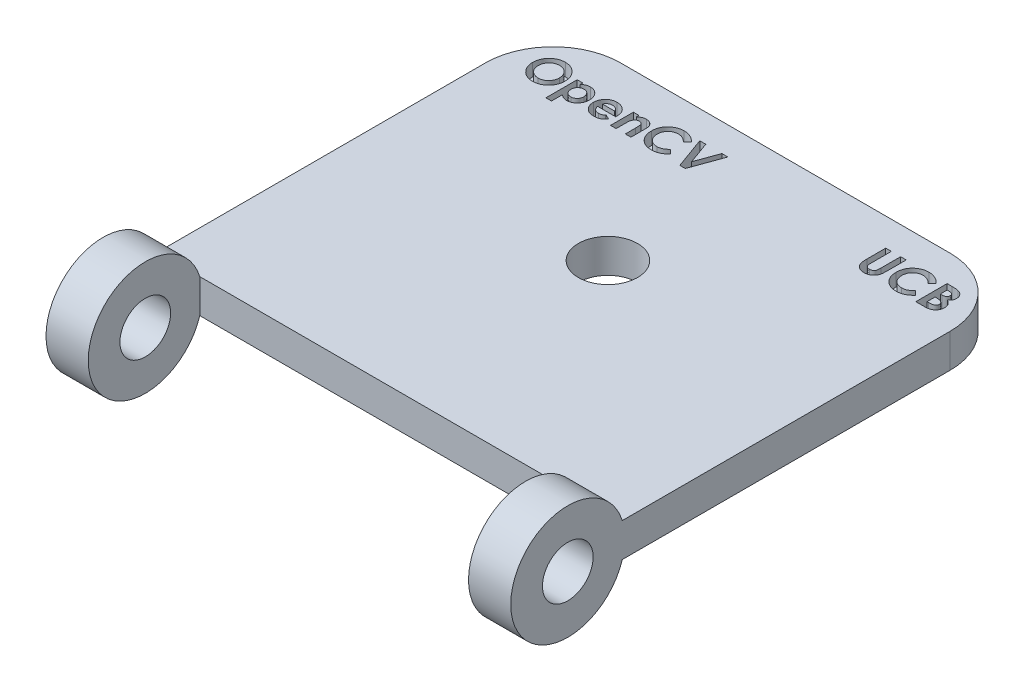
from build123d import *
from build123d.topology import SkipClean

# Parameters (mm, degrees)
CROQUIS1_W                 = 55
CROQUIS1_H                 = 60
SALIENTE_EXTRUIR1_DEPTH    = 4
CROQUIS2_R                 = 6.75
SALIENTE_EXTRUIR2_DEPTH    = 55
CORTAR_EXTRUIR1_DEPTH      = 55
CORTAR_EXTRUIR4_DEPTH      = 72
CROQUIS5_R                 = 3.5
CORTAR_EXTRUIR5_DEPTH      = 72
CORTAR_EXTRUIR6_DEPTH      = 1.5
CORTAR_EXTRUIR8_DEPTH      = 42.627064651
CORTAR_EXTRUIR8_DEPTH_BACK = 42.627064651
CROQUIS7_W                 = 45
CROQUIS7_H                 = 14.979897435
REDONDEO1_R                = 8


with BuildPart() as part:
    # Croquis1 → Saliente-Extruir1 (new body)
    with BuildSketch(Plane(origin=(0, 0, 0), x_dir=(1, 0, 0), z_dir=(0, 1, 0))):
        Rectangle(CROQUIS1_W, CROQUIS1_H)
    extrude(amount=SALIENTE_EXTRUIR1_DEPTH)

    # Croquis2 → Saliente-Extruir2 (add)
    with BuildSketch(Plane(origin=(27.5, 0, 0), x_dir=(0, 0, -1), z_dir=(1, 0, 0))):
        with Locations((-23.25, 2)):
            Circle(CROQUIS2_R)
    extrude(amount=-SALIENTE_EXTRUIR2_DEPTH)

    # Croquis3 → Cortar-Extruir1 (cut)
    with BuildSketch(Plane(origin=(27.5, 0, 0), x_dir=(0, 0, -1), z_dir=(1, 0, 0))):
        with BuildLine():
            ThreePointArc((-20.25, 2), (-21.128679656, 4.121320344), (-23.25, 5))
            Line((-23.25, 5), (-23.25, -1))
            ThreePointArc((-23.25, -1), (-21.128679656, -0.121320344), (-20.25, 2))
        make_face()
        with BuildLine():
            Line((-23.25, -1), (-23.25, 5))
            ThreePointArc((-23.25, 5), (-26.25, 2), (-23.25, -1))
        make_face()
    extrude(amount=-CORTAR_EXTRUIR1_DEPTH, mode=Mode.SUBTRACT)

    # Croquis4 → Cortar-Extruir4 (cut)
    with SkipClean():  # the faces are left unmerged after this step: merging them gives an invalid solid
        with BuildSketch(Plane(origin=(27.5, 0, 0), x_dir=(0, 0, -1), z_dir=(1, 0, 0))):
            with BuildLine():
                Line((-29.696898479, 4), (-30.340484791, 4))
                Line((-30.340484791, 4), (-30.340484791, 0))
                Line((-30.340484791, 0), (-29.696898479, 0))
                ThreePointArc((-29.696898479, 0), (-30, 2), (-29.696898479, 4))
            make_face()
        extrude(amount=-CORTAR_EXTRUIR4_DEPTH, mode=Mode.SUBTRACT)

    # Croquis5 → Cortar-Extruir5 (cut)
    with SkipClean():  # the faces are left unmerged after this step: merging them gives an invalid solid
        with BuildSketch(Plane.XZ):
            with Locations(Location((0, -9, 0), (0, 0, 270))):
                Circle(CROQUIS5_R)
        extrude(amount=-CORTAR_EXTRUIR5_DEPTH, mode=Mode.SUBTRACT)

    # Croquis6 → Cortar-Extruir6 (cut)
    # profile 1 of 9: a face of its own
    with SkipClean():  # the faces are left unmerged after this step: merging them gives an invalid solid
        with BuildSketch(Plane(origin=(0, 4, 0), x_dir=(1, 0, 0), z_dir=(0, 1, 0))):
            with BuildLine():
                add(Edge.make_bspline(
                    [(-22.831815905, 26.799145299), (-22.767414428, 26.79747783), (-22.640271326, 26.794185867), (-22.453289703, 26.766744789), (-22.273098337, 26.722033487), (-22.099778709, 26.659881544), (-21.933764792, 26.578605568), (-21.774470999, 26.480509787), (-21.622467913, 26.363742702), (-21.47931314, 26.231028297), (-21.347012312, 26.086707176), (-21.232373566, 25.931319831), (-21.13461385, 25.768892504), (-21.053590336, 25.598989967), (-20.991875848, 25.420435563), (-20.94856824, 25.234139684), (-20.920745247, 25.040155329), (-20.917545175, 24.908078423), (-20.915918803, 24.840953025)],
                    knots=[0, 0, 0, 0, 1.014329547, 2.002516266, 2.970391464, 3.935626869, 4.897733899, 5.877609409, 6.878433252, 7.912639331, 8.949961323, 9.958554974, 10.949718813, 11.932905612, 12.9188844, 13.919928257, 14.942845884, 16, 16, 16, 16], degree=3))
                add(Edge.make_bspline(
                    [(-20.915918803, 24.840953025), (-20.917650819, 24.774583975), (-20.921063811, 24.643801632), (-20.947432384, 24.451604919), (-20.991469298, 24.267304657), (-21.052137059, 24.090483678), (-21.131691113, 23.921998441), (-21.227544408, 23.760773192), (-21.342226331, 23.608304141), (-21.471553981, 23.464673107), (-21.613932501, 23.334297124), (-21.764733955, 23.219403514), (-21.923262036, 23.122047005), (-22.08928471, 23.04227219), (-22.263158004, 22.980361894), (-22.44445243, 22.936679682), (-22.633156769, 22.91013312), (-22.761484871, 22.906742421), (-22.826621761, 22.905021368)],
                    knots=[0, 0, 0, 0, 1.051557043, 2.072126891, 3.067553643, 4.050577992, 5.02905126, 6.015227836, 7.017913613, 8.04756643, 9.074058332, 10.072836633, 11.047628519, 12.017157415, 12.98668631, 13.966869689, 14.968021931, 16, 16, 16, 16], degree=3))
                add(Edge.make_bspline(
                    [(-22.826621761, 22.905021368), (-22.894747139, 22.906565238), (-23.028604193, 22.909598731), (-23.224504592, 22.93844587), (-23.412194101, 22.981899739), (-23.59009602, 23.046752307), (-23.76002213, 23.127823469), (-23.920723931, 23.227667467), (-24.072147419, 23.346119299), (-24.213424003, 23.480145371), (-24.34142093, 23.62679929), (-24.454403325, 23.781726151), (-24.549706481, 23.943742447), (-24.627333886, 24.112924007), (-24.688532214, 24.288219408), (-24.731700681, 24.47069625), (-24.757201324, 24.659916887), (-24.760753416, 24.788439326), (-24.762553419, 24.853567374)],
                    knots=[0, 0, 0, 0, 1.067978421, 2.098431617, 3.099715153, 4.085208694, 5.062210972, 6.048429807, 7.046490867, 8.072918869, 9.098532598, 10.095778865, 11.076610158, 12.041847152, 13.011192615, 13.984257998, 14.978533688, 16, 16, 16, 16], degree=3))
                add(Edge.make_bspline(
                    [(-24.762553419, 24.853567374), (-24.761988474, 24.897382116), (-24.760865738, 24.984456803), (-24.747341202, 25.113497045), (-24.727869759, 25.240018595), (-24.699072418, 25.363517009), (-24.66409101, 25.484863511), (-24.618767653, 25.602928579), (-24.567177408, 25.718973471), (-24.506899063, 25.831627552), (-24.439875373, 25.939854311), (-24.36674656, 26.043143223), (-24.287328742, 26.140245374), (-24.20187775, 26.231798879), (-24.11009911, 26.317201951), (-24.013200073, 26.397663589), (-23.909301364, 26.471046445), (-23.800676998, 26.539142676), (-23.687939375, 26.600720917), (-23.57154744, 26.653134474), (-23.453899096, 26.69890634), (-23.333422719, 26.735031521), (-23.21140943, 26.764455103), (-23.086555762, 26.783913423), (-22.959989697, 26.797437584), (-22.874641897, 26.79857471), (-22.831815905, 26.799145299)],
                    knots=[0, 0, 0, 0, 1.034744296, 2.056386356, 3.06226378, 4.057406941, 5.050368692, 6.043467995, 7.042652155, 8.049140477, 9.059438543, 10.048523776, 11.036952808, 12.020949711, 13.004946614, 13.997082645, 14.994316842, 16.007702937, 17.024872941, 18.026463647, 19.021641123, 20.005082605, 20.995858141, 21.984425357, 22.988620895, 24, 24, 24, 24], degree=3))
            make_face()
            with BuildLine():
                add(Edge.make_bspline(
                    [(-22.842204193, 26.134294872), (-22.885546379, 26.133131904), (-22.971086509, 26.13083667), (-23.096558303, 26.113350093), (-23.217015655, 26.085422042), (-23.331790824, 26.044968602), (-23.441381255, 25.993481639), (-23.545981219, 25.931141056), (-23.644142221, 25.855803965), (-23.737173144, 25.771514878), (-23.821211274, 25.677597464), (-23.895461613, 25.576948983), (-23.957597188, 25.469737516), (-24.009636121, 25.356959032), (-24.048809904, 25.237345367), (-24.076712215, 25.111833467), (-24.094345434, 24.98020707), (-24.096568124, 24.890477526), (-24.097702991, 24.844663128)],
                    knots=[0, 0, 0, 0, 1.033739768, 2.040188636, 3.016340934, 3.979330865, 4.937572243, 5.900995986, 6.878200029, 7.884839167, 8.891893314, 9.879764717, 10.863503415, 11.843163062, 12.837761627, 13.859916423, 14.907309254, 16, 16, 16, 16], degree=3))
                add(Edge.make_bspline(
                    [(-24.097702991, 24.844663128), (-24.09619833, 24.793890468), (-24.093249443, 24.694384468), (-24.072500715, 24.549227797), (-24.037001707, 24.412141727), (-23.985741829, 24.283796727), (-23.922166132, 24.162767622), (-23.843215207, 24.050537794), (-23.750167685, 23.946435265), (-23.678484627, 23.885655873), (-23.642102364, 23.854807692)],
                    knots=[0, 0, 0, 0, 1.078454662, 2.113592447, 3.107694534, 4.079536787, 5.043276885, 6.005368276, 6.987637804, 8, 8, 8, 8], degree=3))
                add(Edge.make_bspline(
                    [(-23.642102364, 23.854807692), (-23.612298344, 23.832018241), (-23.553361794, 23.78695279), (-23.459286229, 23.729192169), (-23.362406921, 23.679685554), (-23.261992795, 23.639684795), (-23.15825592, 23.608220871), (-23.051210521, 23.586187202), (-22.941008273, 23.572359169), (-22.866484348, 23.570706457), (-22.828847823, 23.569871795)],
                    knots=[0, 0, 0, 0, 1.023928204, 2.024787132, 3.009472467, 3.9914905, 4.972207045, 5.96565515, 6.972602802, 8, 8, 8, 8], degree=3))
                add(Edge.make_bspline(
                    [(-22.828847823, 23.569871795), (-22.786250907, 23.571044624), (-22.702440136, 23.573352201), (-22.579304068, 23.590623509), (-22.461335975, 23.619852797), (-22.347803501, 23.659951366), (-22.239034023, 23.712084791), (-22.135559127, 23.776358984), (-22.037197393, 23.851984738), (-21.94428499, 23.937380725), (-21.859358662, 24.031668109), (-21.785263268, 24.132853438), (-21.721152093, 24.238707299), (-21.67019531, 24.350727891), (-21.629473859, 24.467857792), (-21.601907367, 24.590615746), (-21.584125187, 24.718495698), (-21.581901871, 24.805522525), (-21.580769231, 24.849857272)],
                    knots=[0, 0, 0, 0, 1.026359118, 2.019393844, 2.989460624, 3.950973911, 4.916101784, 5.890408035, 6.881132271, 7.902007068, 8.92769091, 9.933912415, 10.920395702, 11.90457117, 12.894218921, 13.903490204, 14.931958862, 16, 16, 16, 16], degree=3))
                add(Edge.make_bspline(
                    [(-21.580769231, 24.849857272), (-21.581941061, 24.893937081), (-21.58424763, 24.980701464), (-21.601549336, 25.108252638), (-21.63059326, 25.230468652), (-21.67081224, 25.347549097), (-21.722169748, 25.459608757), (-21.785678517, 25.566253564), (-21.861115702, 25.667380417), (-21.946745122, 25.762300176), (-22.039947482, 25.849525354), (-22.140009528, 25.925220953), (-22.244131412, 25.990998022), (-22.354702198, 26.042525121), (-22.4694597, 26.083576652), (-22.589104175, 26.113807589), (-22.714088783, 26.130713826), (-22.799118396, 26.13309055), (-22.842204193, 26.134294872)],
                    knots=[0, 0, 0, 0, 1.055025985, 2.07665775, 3.074803781, 4.057872707, 5.035505728, 6.020516407, 7.023567878, 8.050795229, 9.077271434, 10.074415901, 11.050397877, 12.019801805, 12.988065821, 13.964604439, 14.968634123, 16, 16, 16, 16], degree=3))
            make_face(mode=Mode.SUBTRACT)
        # profile 2 of 9: a face of its own
        with BuildSketch(Plane(origin=(0, 4, 0), x_dir=(1, 0, 0), z_dir=(0, 1, 0))):
            with BuildLine():
                Line((-19.681196581, 25.706891026), (-19.681196581, 25.401920573))
                add(Edge.make_bspline(
                    [(-19.681196581, 25.401920573), (-19.650330497, 25.430279773), (-19.589712693, 25.485974315), (-19.490464949, 25.557279954), (-19.388472911, 25.618520433), (-19.281862583, 25.667777408), (-19.172097048, 25.706588005), (-19.058192745, 25.733858099), (-18.940987103, 25.751843458), (-18.861330635, 25.75353037), (-18.821194745, 25.754380342)],
                    knots=[0, 0, 0, 0, 1.054376801, 2.070687235, 3.070225973, 4.045259405, 5.022040922, 5.996139433, 6.99033025, 8, 8, 8, 8], degree=3))
                add(Edge.make_bspline(
                    [(-18.821194745, 25.754380342), (-18.777594579, 25.753336008), (-18.691716399, 25.751279009), (-18.565362998, 25.732073969), (-18.444276078, 25.701030344), (-18.327993903, 25.657684982), (-18.217136011, 25.601408269), (-18.110456835, 25.53402753), (-18.009796182, 25.452762268), (-17.915105119, 25.360715732), (-17.827513527, 25.259825891), (-17.751324973, 25.150137222), (-17.687862864, 25.033093437), (-17.634075608, 24.910078238), (-17.594819509, 24.779051461), (-17.564564183, 24.64177074), (-17.547704217, 24.497074652), (-17.545368211, 24.398502149), (-17.54417735, 24.348251369)],
                    knots=[0, 0, 0, 0, 0.985987466, 1.942075377, 2.884088208, 3.810275091, 4.743821533, 5.692411115, 6.659945104, 7.665215984, 8.677116751, 9.678438675, 10.680260931, 11.685531812, 12.710472044, 13.769734641, 14.863044265, 16, 16, 16, 16], degree=3))
                add(Edge.make_bspline(
                    [(-17.54417735, 24.348251369), (-17.545304421, 24.299720807), (-17.547526125, 24.20405637), (-17.565476095, 24.063613104), (-17.595899791, 23.929449972), (-17.638578071, 23.801518656), (-17.692833664, 23.679414871), (-17.759056359, 23.563222754), (-17.837632448, 23.45334816), (-17.927465195, 23.351271212), (-18.025620525, 23.258832947), (-18.127891344, 23.175897445), (-18.23631455, 23.107938305), (-18.348179804, 23.050541604), (-18.465249409, 23.006651458), (-18.586723728, 22.975901478), (-18.712410375, 22.955343208), (-18.797861986, 22.953464262), (-18.8412293, 22.952510684)],
                    knots=[0, 0, 0, 0, 1.098553145, 2.165490463, 3.199345634, 4.208780719, 5.21409072, 6.219899742, 7.23156933, 8.267303578, 9.293302409, 10.281606823, 11.243293419, 12.184993323, 13.124258899, 14.066907486, 15.018941492, 16, 16, 16, 16], degree=3))
                add(Edge.make_bspline(
                    [(-18.8412293, 22.952510684), (-18.879874596, 22.953447909), (-18.956003503, 22.955294186), (-19.06794929, 22.971756088), (-19.176090191, 22.996344574), (-19.280569255, 23.033352987), (-19.382561013, 23.08246284), (-19.483802512, 23.143620283), (-19.584527861, 23.218334509), (-19.648282325, 23.275961581), (-19.681196581, 23.305712473)],
                    knots=[0, 0, 0, 0, 0.990856396, 1.951927477, 2.896945079, 3.83213376, 4.788585491, 5.796263726, 6.862286081, 8, 8, 8, 8], degree=3))
                Line((-19.681196581, 23.305712473), (-19.681196581, 22.002724359))
                Line((-19.681196581, 22.002724359), (-20.346047009, 22.002724359))
                Line((-20.346047009, 22.002724359), (-20.346047009, 25.706891026))
                Line((-20.346047009, 25.706891026), (-19.681196581, 25.706891026))
            make_face()
            with BuildLine():
                add(Edge.make_bspline(
                    [(-18.965146735, 25.137019231), (-18.992128349, 25.136189528), (-19.045026979, 25.134562858), (-19.122691804, 25.125240424), (-19.196280593, 25.107700196), (-19.266912203, 25.084966264), (-19.333692237, 25.054279026), (-19.397167029, 25.017079786), (-19.456792913, 24.972722532), (-19.512879345, 24.922963756), (-19.563277464, 24.86698504), (-19.60805182, 24.807168878), (-19.645198113, 24.742736352), (-19.676163596, 24.674504458), (-19.699525701, 24.601734934), (-19.716853614, 24.525046832), (-19.726270236, 24.444205136), (-19.727867942, 24.389084892), (-19.728685897, 24.360865718)],
                    knots=[0, 0, 0, 0, 1.060469436, 2.079096586, 3.066888298, 4.028858836, 4.99004353, 5.948472697, 6.914558426, 7.905691313, 8.889602648, 9.869280844, 10.836099585, 11.806137001, 12.808075328, 13.83377171, 14.890985086, 16, 16, 16, 16], degree=3))
                add(Edge.make_bspline(
                    [(-19.728685897, 24.360865718), (-19.727857649, 24.332152686), (-19.726232177, 24.275802124), (-19.716894054, 24.193236587), (-19.699687765, 24.115012068), (-19.675833611, 24.040951211), (-19.645395046, 23.971044407), (-19.608292765, 23.905032502), (-19.563025559, 23.844362772), (-19.513181082, 23.786908139), (-19.456747854, 23.73648358), (-19.397390586, 23.691259687), (-19.333707658, 23.654004998), (-19.26660848, 23.623819893), (-19.196602196, 23.598736236), (-19.122645578, 23.581787235), (-19.045039245, 23.572291912), (-18.992132492, 23.570689252), (-18.965146735, 23.569871795)],
                    knots=[0, 0, 0, 0, 1.117193555, 2.192540452, 3.22680955, 4.227918444, 5.21468246, 6.188555072, 7.166222992, 8.154674427, 9.142376254, 10.104580718, 11.053462639, 12.005072638, 12.963662044, 13.941614018, 14.950094269, 16, 16, 16, 16], degree=3))
                add(Edge.make_bspline(
                    [(-18.965146735, 23.569871795), (-18.939142576, 23.570631187), (-18.88766926, 23.572134349), (-18.812355077, 23.582622883), (-18.739959384, 23.599762191), (-18.671049134, 23.624191904), (-18.605204845, 23.655999366), (-18.541827087, 23.69321936), (-18.483103901, 23.739722965), (-18.426731478, 23.790834397), (-18.376293219, 23.848473391), (-18.331044039, 23.909707232), (-18.293033383, 23.975082443), (-18.262853818, 24.044815817), (-18.237903512, 24.117586504), (-18.22086915, 24.194726459), (-18.211497156, 24.275547153), (-18.209859082, 24.330666983), (-18.209027778, 24.358639657)],
                    knots=[0, 0, 0, 0, 1.021711385, 2.02240246, 2.981887075, 3.941027022, 4.888772411, 5.852236371, 6.822344989, 7.82661704, 8.838806642, 9.826383926, 10.814965113, 11.80282933, 12.807900643, 13.833672313, 14.900613836, 16, 16, 16, 16], degree=3))
                add(Edge.make_bspline(
                    [(-18.209027778, 24.358639657), (-18.209872357, 24.386360671), (-18.211536415, 24.440978831), (-18.22071649, 24.521126504), (-18.238406701, 24.597144977), (-18.260742843, 24.669655264), (-18.291948436, 24.737713471), (-18.328845903, 24.802124715), (-18.372262609, 24.863083482), (-18.422627859, 24.918944183), (-18.477869662, 24.969773408), (-18.536839345, 25.014732276), (-18.599305329, 25.053005083), (-18.666118265, 25.083187527), (-18.735701472, 25.108021173), (-18.809118328, 25.125126916), (-18.885995587, 25.134594192), (-18.938408662, 25.136200028), (-18.965146735, 25.137019231)],
                    knots=[0, 0, 0, 0, 1.094680664, 2.156827393, 3.177782763, 4.17210342, 5.146667393, 6.126451192, 7.099203661, 8.094961544, 9.09004898, 10.058676268, 11.018205477, 11.974998356, 12.947750825, 13.930643515, 14.944335875, 16, 16, 16, 16], degree=3))
            make_face(mode=Mode.SUBTRACT)
        # profile 3 of 9: a face of its own
        with BuildSketch(Plane(origin=(0, 4, 0), x_dir=(1, 0, 0), z_dir=(0, 1, 0))):
            with BuildLine():
                Line((-14.269640592, 24.187232906), (-16.404433761, 24.187232906))
                add(Edge.make_bspline(
                    [(-16.404433761, 24.187232906), (-16.40008109, 24.16242782), (-16.391527748, 24.11368387), (-16.372953863, 24.042879053), (-16.349250799, 23.976153789), (-16.32084417, 23.913418881), (-16.288212911, 23.854342677), (-16.25015125, 23.799202265), (-16.207141967, 23.748046349), (-16.159433727, 23.701097259), (-16.107821742, 23.659029857), (-16.05255631, 23.622176154), (-15.993580401, 23.591958372), (-15.931570151, 23.566487917), (-15.866062202, 23.546312736), (-15.796960141, 23.532398298), (-15.724447149, 23.524178988), (-15.675049083, 23.522990159), (-15.649798845, 23.522382479)],
                    knots=[0, 0, 0, 0, 1.091296461, 2.144483647, 3.168565212, 4.157007626, 5.126487748, 6.090021542, 7.05641414, 8.019231907, 8.98705074, 9.938580405, 10.892824166, 11.854447369, 12.841318655, 13.858982407, 14.905600794, 16, 16, 16, 16], degree=3))
                add(Edge.make_bspline(
                    [(-15.649798845, 23.522382479), (-15.619320093, 23.523187147), (-15.559298456, 23.524771776), (-15.47136631, 23.538825084), (-15.386323117, 23.560051987), (-15.304973683, 23.591618174), (-15.226375704, 23.630912528), (-15.151823144, 23.679868458), (-15.080025557, 23.737055312), (-15.036220567, 23.781134917), (-15.01388722, 23.803608273)],
                    knots=[0, 0, 0, 0, 1.021034703, 2.010718019, 2.977989445, 3.954245119, 4.929443971, 5.918328161, 6.938689359, 8, 8, 8, 8], degree=3))
                Line((-15.01388722, 23.803608273), (-14.457371795, 23.538706931))
                add(Edge.make_bspline(
                    [(-14.457371795, 23.538706931), (-14.474893358, 23.51449482), (-14.509611692, 23.466519411), (-14.566288206, 23.399005621), (-14.625433757, 23.336012516), (-14.687092457, 23.277954411), (-14.751342503, 23.22499675), (-14.818005167, 23.176494411), (-14.888054698, 23.133749663), (-14.960090467, 23.094694542), (-15.035601587, 23.061212767), (-15.114379086, 23.032660692), (-15.196089296, 23.006849858), (-15.281764041, 22.987183417), (-15.370689908, 22.971615623), (-15.463079625, 22.960560427), (-15.558921016, 22.953732162), (-15.624063851, 22.952922679), (-15.65721905, 22.952510684)],
                    knots=[0, 0, 0, 0, 1.028154879, 2.037251081, 3.030720504, 4.000128189, 4.949298328, 5.894184978, 6.834267904, 7.770992897, 8.712077017, 9.673380525, 10.653304757, 11.658697181, 12.695551717, 13.758623199, 14.859225354, 16, 16, 16, 16], degree=3))
                add(Edge.make_bspline(
                    [(-15.65721905, 22.952510684), (-15.70822778, 22.953550598), (-15.808125437, 22.955587211), (-15.95424382, 22.974489891), (-16.093015756, 23.005832573), (-16.224833089, 23.048438135), (-16.349126016, 23.104690824), (-16.465956051, 23.173492529), (-16.576490493, 23.253524184), (-16.677351897, 23.34646544), (-16.769239612, 23.447626472), (-16.849948067, 23.556266512), (-16.917483754, 23.671626533), (-16.972945418, 23.79294306), (-17.016052149, 23.920526613), (-17.047129603, 24.054432869), (-17.066180454, 24.194597872), (-17.06823804, 24.290065885), (-17.069284188, 24.338605101)],
                    knots=[0, 0, 0, 0, 1.103565453, 2.161269334, 3.182010356, 4.179077853, 5.15417608, 6.128274628, 7.109042802, 8.101804412, 9.090965879, 10.063106201, 11.02526161, 11.978650795, 12.945248442, 13.93468508, 14.949922959, 16, 16, 16, 16], degree=3))
                add(Edge.make_bspline(
                    [(-17.069284188, 24.338605101), (-17.068227744, 24.388377762), (-17.066149238, 24.486303236), (-17.04729363, 24.629704713), (-17.015966231, 24.766529117), (-16.972733402, 24.896964871), (-16.918113099, 25.021419922), (-16.849718137, 25.138805437), (-16.769279663, 25.249530088), (-16.677722972, 25.353075895), (-16.576434288, 25.446537299), (-16.468805491, 25.529830087), (-16.353627263, 25.599235167), (-16.232202367, 25.655314428), (-16.105307482, 25.700877412), (-15.971475879, 25.731195773), (-15.831725814, 25.751552738), (-15.736195746, 25.753427487), (-15.687641894, 25.754380342)],
                    knots=[0, 0, 0, 0, 1.079208495, 2.12329425, 3.130605359, 4.119693003, 5.099659317, 6.073216462, 7.060498243, 8.06384408, 9.066070512, 10.045757761, 11.010926815, 11.975797609, 12.942977511, 13.929384301, 14.947594487, 16, 16, 16, 16], degree=3))
                add(Edge.make_bspline(
                    [(-15.687641894, 25.754380342), (-15.636388798, 25.753324294), (-15.535758625, 25.751250852), (-15.388622573, 25.732501657), (-15.248929209, 25.700967852), (-15.116083359, 25.658730692), (-14.991781521, 25.601057001), (-14.873292405, 25.533948397), (-14.763458053, 25.452186797), (-14.661107748, 25.359700366), (-14.56871568, 25.257089875), (-14.487954775, 25.145623455), (-14.419237185, 25.026388953), (-14.363540897, 24.898902846), (-14.320478427, 24.763547861), (-14.289372206, 24.620499783), (-14.270466668, 24.469214526), (-14.268447368, 24.365620839), (-14.26741453, 24.312634382)],
                    knots=[0, 0, 0, 0, 1.080001299, 2.120471247, 3.119684163, 4.095710327, 5.052285597, 6.002875087, 6.961153713, 7.931888285, 8.906493152, 9.865905668, 10.82813294, 11.801621613, 12.7925306, 13.817193356, 14.883530496, 16, 16, 16, 16], degree=3))
                Line((-14.26741453, 24.312634382), (-14.269640592, 24.187232906))
            make_face()
            with BuildLine():
                add(Edge.make_bspline(
                    [(-14.932264957, 24.709615385), (-14.944811091, 24.743472319), (-14.969756075, 24.810788723), (-15.026105753, 24.903668936), (-15.100879974, 24.984106973), (-15.187847756, 25.055319404), (-15.287213894, 25.113119862), (-15.395847185, 25.154969271), (-15.512374525, 25.180062701), (-15.592539056, 25.18300572), (-15.633474392, 25.184508547)],
                    knots=[0, 0, 0, 0, 0.954238005, 1.897273737, 2.851915805, 3.847685534, 4.862635127, 5.880135777, 6.917509367, 8, 8, 8, 8], degree=3))
                add(Edge.make_bspline(
                    [(-15.633474392, 25.184508547), (-15.678182444, 25.183064898), (-15.765577376, 25.180242866), (-15.891638615, 25.150229513), (-16.010549027, 25.105435482), (-16.080651867, 25.059251884), (-16.11578776, 25.036104434)],
                    knots=[0, 0, 0, 0, 1.044195649, 2.041185066, 3.018232172, 4, 4, 4, 4], degree=3))
                add(Edge.make_bspline(
                    [(-16.11578776, 25.036104434), (-16.137709934, 25.018474829), (-16.184446887, 24.980889412), (-16.245144302, 24.905910075), (-16.304931761, 24.815126929), (-16.338924228, 24.746170716), (-16.356944444, 24.709615385)],
                    knots=[0, 0, 0, 0, 0.82159062, 1.751589201, 2.808063854, 4, 4, 4, 4], degree=3))
                Line((-16.356944444, 24.709615385), (-14.932264957, 24.709615385))
            make_face(mode=Mode.SUBTRACT)
        # profile 4 of 9: a face of its own
        with BuildSketch(Plane(origin=(0, 4, 0), x_dir=(1, 0, 0), z_dir=(0, 1, 0))):
            with BuildLine():
                Line((-13.697542735, 25.706891026), (-13.032692308, 25.706891026))
                Line((-13.032692308, 25.706891026), (-13.032692308, 25.420471087))
                add(Edge.make_bspline(
                    [(-13.032692308, 25.420471087), (-12.99476292, 25.449973346), (-12.922272488, 25.506357897), (-12.812074515, 25.578248487), (-12.708061272, 25.637088049), (-12.607914192, 25.68184443), (-12.509749006, 25.714044722), (-12.411975857, 25.737178711), (-12.313138707, 25.75199204), (-12.24669615, 25.753584668), (-12.213501603, 25.754380342)],
                    knots=[0, 0, 0, 0, 1.276643801, 2.439914479, 3.493451431, 4.44993799, 5.350072675, 6.235028322, 7.118224225, 8, 8, 8, 8], degree=3))
                add(Edge.make_bspline(
                    [(-12.213501603, 25.754380342), (-12.179830201, 25.753471052), (-12.113730411, 25.751686039), (-12.016402113, 25.739201319), (-11.923414377, 25.71646269), (-11.833721631, 25.68627194), (-11.748236795, 25.646421882), (-11.665912627, 25.599106403), (-11.588517422, 25.541472949), (-11.540854028, 25.497582078), (-11.516744291, 25.475380609)],
                    knots=[0, 0, 0, 0, 1.048836932, 2.058954983, 3.049370783, 4.026390553, 5.001981509, 5.982488534, 6.97947532, 8, 8, 8, 8], degree=3))
                add(Edge.make_bspline(
                    [(-11.516744291, 25.475380609), (-11.497407395, 25.45480634), (-11.458592079, 25.413507222), (-11.409747881, 25.342833854), (-11.367834066, 25.265786946), (-11.333491518, 25.181477739), (-11.308113758, 25.089443007), (-11.288590301, 24.990794399), (-11.277635349, 24.884979555), (-11.276282909, 24.812285756), (-11.275587607, 24.774913194)],
                    knots=[0, 0, 0, 0, 0.889584746, 1.785680191, 2.700364693, 3.65222533, 4.649950538, 5.707241244, 6.821271309, 8, 8, 8, 8], degree=3))
                Line((-11.275587607, 24.774913194), (-11.275587607, 23))
                Line((-11.275587607, 23), (-11.940438034, 23))
                Line((-11.940438034, 23), (-11.940438034, 24.175360577))
                add(Edge.make_bspline(
                    [(-11.940438034, 24.175360577), (-11.940578635, 24.213698791), (-11.940848071, 24.287166864), (-11.942916744, 24.392310716), (-11.946955999, 24.487269269), (-11.950637674, 24.572215415), (-11.957866266, 24.646847537), (-11.964385128, 24.711638115), (-11.974387688, 24.765999363), (-11.987402642, 24.824473041), (-12.010129957, 24.887079807), (-12.045413006, 24.953046378), (-12.090174502, 25.009086451), (-12.142586205, 25.055592894), (-12.202590232, 25.092383756), (-12.269461521, 25.11826842), (-12.342841563, 25.134400377), (-12.393971914, 25.136124069), (-12.420525341, 25.137019231)],
                    knots=[0, 0, 0, 0, 1.49886392, 2.872294502, 4.110984203, 5.214877267, 6.195405875, 7.042225351, 7.75923308, 8.355011229, 9.382752534, 10.352059385, 11.267231453, 12.171456522, 13.078624015, 14.003401117, 14.963110155, 16, 16, 16, 16], degree=3))
                add(Edge.make_bspline(
                    [(-12.420525341, 25.137019231), (-12.455059189, 25.13526801), (-12.522614109, 25.131842282), (-12.620318786, 25.106009167), (-12.710058904, 25.062074643), (-12.791101213, 25.001278095), (-12.862673851, 24.926217224), (-12.921622975, 24.836698525), (-12.969973367, 24.734882525), (-12.990764754, 24.660540308), (-13.001527444, 24.622056958)],
                    knots=[0, 0, 0, 0, 0.984188326, 1.925263693, 2.85911992, 3.81709677, 4.80007086, 5.801799564, 6.862098548, 8, 8, 8, 8], degree=3))
                add(Edge.make_bspline(
                    [(-13.001527444, 24.622056958), (-13.0042024, 24.609971004), (-13.01016809, 24.583016896), (-13.015074115, 24.537480878), (-13.021898752, 24.483456802), (-13.024455776, 24.419966983), (-13.028902159, 24.347311892), (-13.030546643, 24.26539541), (-13.032194071, 24.174378159), (-13.032520727, 24.110806067), (-13.032692308, 24.077413862)],
                    knots=[0, 0, 0, 0, 0.543362196, 1.211806945, 2.009705693, 2.934833164, 4.000995085, 5.207458376, 6.533175157, 8, 8, 8, 8], degree=3))
                Line((-13.032692308, 24.077413862), (-13.032692308, 23))
                Line((-13.032692308, 23), (-13.697542735, 23))
                Line((-13.697542735, 23), (-13.697542735, 25.706891026))
            make_face()
        # profile 5 of 9: a face of its own
        with BuildSketch(Plane(origin=(0, 4, 0), x_dir=(1, 0, 0), z_dir=(0, 1, 0))):
            with BuildLine():
                Line((-7.19150641, 26.061576856), (-7.679013922, 25.595587941))
                add(Edge.make_bspline(
                    [(-7.679013922, 25.595587941), (-7.720368281, 25.638348417), (-7.8011463, 25.721873024), (-7.931310087, 25.832452242), (-8.066675686, 25.924605059), (-8.204609829, 26.002215574), (-8.347593553, 26.06093346), (-8.493973576, 26.103722173), (-8.644684577, 26.129808834), (-8.746679985, 26.13279361), (-8.797980936, 26.134294872)],
                    knots=[0, 0, 0, 0, 1.115251505, 2.178435587, 3.19620269, 4.182487026, 5.141301733, 6.088180966, 7.038406374, 8, 8, 8, 8], degree=3))
                add(Edge.make_bspline(
                    [(-8.797980936, 26.134294872), (-8.840823465, 26.133108822), (-8.925368474, 26.130768284), (-9.049502703, 26.113609833), (-9.168243509, 26.084431139), (-9.281997359, 26.044217494), (-9.390429529, 25.992183172), (-9.49376736, 25.928368446), (-9.591756077, 25.853349654), (-9.683101305, 25.767514946), (-9.76666071, 25.673734077), (-9.840490764, 25.573670114), (-9.902335278, 25.467552297), (-9.953090064, 25.35645531), (-9.992626081, 25.239864941), (-10.020859764, 25.117859683), (-10.037189372, 24.990294237), (-10.039626675, 24.903576198), (-10.040865385, 24.859503539)],
                    knots=[0, 0, 0, 0, 1.035432265, 2.043311493, 3.022114605, 3.98653278, 4.95457646, 5.923598177, 6.917315552, 7.932509744, 8.948865224, 9.949768934, 10.933144597, 11.912367597, 12.897413939, 13.903909035, 14.934704909, 16, 16, 16, 16], degree=3))
                add(Edge.make_bspline(
                    [(-10.040865385, 24.859503539), (-10.040508403, 24.828570263), (-10.039804784, 24.767600142), (-10.032102434, 24.67740841), (-10.019699834, 24.589901108), (-10.001750198, 24.505210786), (-9.979304003, 24.42326405), (-9.952969505, 24.343353951), (-9.919933264, 24.266584665), (-9.883262538, 24.192064568), (-9.840614907, 24.121827033), (-9.794632893, 24.054849714), (-9.744772907, 23.991460928), (-9.690712001, 23.931919809), (-9.631689336, 23.877156852), (-9.56923043, 23.82552527), (-9.502281688, 23.778317576), (-9.432233804, 23.734349041), (-9.358481652, 23.696153201), (-9.283026301, 23.661555148), (-9.204723695, 23.633456386), (-9.124527214, 23.61080622), (-9.042723454, 23.591545636), (-8.958512297, 23.579686303), (-8.872623749, 23.570705369), (-8.814577506, 23.570150849), (-8.785366587, 23.569871795)],
                    knots=[0, 0, 0, 0, 1.103660481, 2.175337485, 3.227646561, 4.255952547, 5.262355991, 6.258840057, 7.255597736, 8.242457506, 9.22035537, 10.185017736, 11.140346927, 12.096287581, 13.051739095, 14.01125915, 14.986044842, 15.97314143, 16.960198552, 17.947847494, 18.933482797, 19.925264591, 20.920966487, 21.929612487, 22.958107872, 24, 24, 24, 24], degree=3))
                add(Edge.make_bspline(
                    [(-8.785366587, 23.569871795), (-8.735819847, 23.57130495), (-8.638473388, 23.574120726), (-8.495603462, 23.596139697), (-8.359462656, 23.632359658), (-8.250686803, 23.675133328), (-8.165463795, 23.717372882), (-8.10058478, 23.75644239), (-8.033494821, 23.800145924), (-7.965308226, 23.850132903), (-7.89525803, 23.905803462), (-7.824580782, 23.968376893), (-7.751467131, 24.03579274), (-7.703571103, 24.083908754), (-7.679013922, 24.108578726)],
                    knots=[0, 0, 0, 0, 1.404581149, 2.759636711, 4.088442092, 5.392261763, 6.066678138, 6.783632037, 7.538459478, 8.336747902, 9.180226004, 10.074962426, 11.012997595, 12, 12, 12, 12], degree=3))
                Line((-7.679013922, 24.108578726), (-7.206346822, 23.612166967))
                add(Edge.make_bspline(
                    [(-7.206346822, 23.612166967), (-7.239572775, 23.580088353), (-7.304422729, 23.517477757), (-7.402247086, 23.428576554), (-7.499948326, 23.348688941), (-7.595166192, 23.274915346), (-7.689460452, 23.209404975), (-7.782821106, 23.152092401), (-7.874191271, 23.101528106), (-7.965468276, 23.058564832), (-8.057220096, 23.02208455), (-8.151621936, 22.990677422), (-8.248962392, 22.964108121), (-8.349835975, 22.942670185), (-8.453301797, 22.925479855), (-8.560328162, 22.913876481), (-8.670236468, 22.906075919), (-8.744788975, 22.905374974), (-8.782398504, 22.905021368)],
                    knots=[0, 0, 0, 0, 1.244526981, 2.429050516, 3.560637417, 4.644440555, 5.67424972, 6.652764056, 7.595344123, 8.486817594, 9.369275933, 10.254498637, 11.166417451, 12.086725134, 13.032340136, 13.991389299, 14.986715468, 16, 16, 16, 16], degree=3))
                add(Edge.make_bspline(
                    [(-8.782398504, 22.905021368), (-8.85148255, 22.906782458), (-8.986660825, 22.910228421), (-9.184761063, 22.93576068), (-9.37295097, 22.978565062), (-9.55168838, 23.039102265), (-9.720916456, 23.116435704), (-9.880591905, 23.211242869), (-10.030457366, 23.323271872), (-10.169302221, 23.451209625), (-10.294894, 23.592506132), (-10.405902589, 23.744219818), (-10.497728898, 23.9070963), (-10.573974261, 24.078729371), (-10.633597132, 24.259902259), (-10.675561525, 24.45081094), (-10.70144066, 24.651271078), (-10.704271874, 24.788189973), (-10.705715812, 24.858019498)],
                    knots=[0, 0, 0, 0, 1.078019885, 2.10938526, 3.111377082, 4.085535484, 5.04941344, 6.010039228, 6.978205633, 7.964457913, 8.951525778, 9.924444315, 10.892603023, 11.863865945, 12.85144698, 13.863884204, 14.910567087, 16, 16, 16, 16], degree=3))
                add(Edge.make_bspline(
                    [(-10.705715812, 24.858019498), (-10.705105674, 24.903561718), (-10.703896529, 24.993815268), (-10.691188309, 25.126766059), (-10.673472311, 25.256369299), (-10.64536749, 25.381279276), (-10.611489901, 25.50317876), (-10.569358668, 25.620742844), (-10.519041081, 25.734309419), (-10.462158993, 25.844068604), (-10.397808857, 25.949301357), (-10.32592269, 26.049103564), (-10.248351123, 26.144245679), (-10.163230237, 26.233465465), (-10.071796952, 26.317546289), (-9.973638454, 26.396032502), (-9.86934512, 26.470049684), (-9.758634666, 26.537689112), (-9.643657901, 26.598872569), (-9.525864984, 26.652838992), (-9.405545319, 26.697942493), (-9.283207629, 26.735354184), (-9.158335038, 26.763279366), (-9.031818855, 26.784417828), (-8.902582579, 26.796234363), (-8.815811616, 26.798168806), (-8.772010216, 26.799145299)],
                    knots=[0, 0, 0, 0, 1.071919942, 2.124283339, 3.142214191, 4.149696895, 5.136002878, 6.119640489, 7.086990633, 8.058538607, 9.028339693, 9.988281803, 10.952401235, 11.916291999, 12.888973767, 13.874849856, 14.873389453, 15.898127285, 16.927174885, 17.938320013, 18.946391617, 19.950418109, 20.947802303, 21.956882652, 22.968648068, 24, 24, 24, 24], degree=3))
                add(Edge.make_bspline(
                    [(-8.772010216, 26.799145299), (-8.734643131, 26.798585549), (-8.660297474, 26.797471868), (-8.549584315, 26.788188125), (-8.439756588, 26.773608101), (-8.33120751, 26.751609949), (-8.223160627, 26.725495363), (-8.117035796, 26.691301915), (-8.01115884, 26.653186874), (-7.907190283, 26.607628124), (-7.804984999, 26.557896634), (-7.706937309, 26.501474452), (-7.611401, 26.441833736), (-7.5204931, 26.375444689), (-7.432510708, 26.304715363), (-7.347913892, 26.229315767), (-7.267445038, 26.147988768), (-7.216947253, 26.090526443), (-7.19150641, 26.061576856)],
                    knots=[0, 0, 0, 0, 0.996412454, 1.982464992, 2.961075852, 3.949442424, 4.934965278, 5.923860011, 6.921385422, 7.934793307, 8.949617135, 9.951082467, 10.950285876, 11.951772932, 12.951063433, 13.960125323, 14.972308753, 16, 16, 16, 16], degree=3))
            make_face()
        # profile 6 of 9: a face of its own
        with BuildSketch(Plane(origin=(0, 4, 0), x_dir=(1, 0, 0), z_dir=(0, 1, 0))):
            Polygon((-6.835336538, 26.704166667), (-6.125222857, 26.704166667), (-5.17321047, 24.072961739), (-4.218972022, 26.704166667), (-3.511084402, 26.704166667), (-4.854141627, 23), (-5.494505375, 23), align=None)
        # profile 7 of 9: a face of its own
        with BuildSketch(Plane(origin=(0, 4, 0), x_dir=(1, 0, 0), z_dir=(0, 1, 0))):
            with BuildLine():
                Line((22.435576923, 23), (22.435576923, 26.704166667))
                Line((22.435576923, 26.704166667), (23.029193376, 26.704166667))
                add(Edge.make_bspline(
                    [(23.029193376, 26.704166667), (23.070750239, 26.704171409), (23.151161982, 26.704180586), (23.267175142, 26.700106585), (23.37476755, 26.694836408), (23.473596805, 26.688940305), (23.563831122, 26.678780143), (23.645333285, 26.668072441), (23.718266136, 26.655159613), (23.763356554, 26.643576405), (23.784570313, 26.638126836)],
                    knots=[0, 0, 0, 0, 1.311965854, 2.538629056, 3.664479157, 4.713267157, 5.663616078, 6.530575999, 7.308677837, 8, 8, 8, 8], degree=3))
                add(Edge.make_bspline(
                    [(23.784570313, 26.638126836), (23.812426131, 26.630440122), (23.867088189, 26.61535632), (23.945381701, 26.584893932), (24.019654018, 26.551032827), (24.089814456, 26.512403639), (24.155432202, 26.468540007), (24.216257886, 26.419093813), (24.273603368, 26.366049828), (24.32543244, 26.30792973), (24.372277382, 26.24651508), (24.412977238, 26.18182197), (24.448340196, 26.114839601), (24.476639826, 26.044725044), (24.497963065, 25.971801196), (24.513558793, 25.896379452), (24.523666936, 25.818221159), (24.524622023, 25.765047518), (24.525106838, 25.738055889)],
                    knots=[0, 0, 0, 0, 1.099996261, 2.158545794, 3.195537121, 4.207578794, 5.205712374, 6.197378256, 7.190519799, 8.17788031, 9.159561366, 10.129234751, 11.085776129, 12.040971148, 13.00380137, 13.975669004, 14.972423361, 16, 16, 16, 16], degree=3))
                add(Edge.make_bspline(
                    [(24.525106838, 25.738055889), (24.523839192, 25.703378731), (24.521343986, 25.635121005), (24.505404445, 25.534862756), (24.475515321, 25.440104299), (24.436406129, 25.349099274), (24.383229855, 25.262187128), (24.315706272, 25.179409187), (24.234929041, 25.098216593), (24.172968445, 25.04954711), (24.140740184, 25.024232105)],
                    knots=[0, 0, 0, 0, 0.986156485, 1.941127874, 2.875419072, 3.804401753, 4.751181392, 5.761612777, 6.835722519, 8, 8, 8, 8], degree=3))
                add(Edge.make_bspline(
                    [(24.140740184, 25.024232105), (24.16685642, 25.010899993), (24.218063134, 24.984759409), (24.290761624, 24.941792094), (24.35807249, 24.896090905), (24.420297533, 24.848575367), (24.476131513, 24.79723123), (24.527879907, 24.745017013), (24.572989719, 24.688941058), (24.613328273, 24.631002018), (24.648389888, 24.570360931), (24.678924689, 24.507120204), (24.704716339, 24.441063795), (24.726557376, 24.372527876), (24.742846427, 24.301276716), (24.753467235, 24.227284833), (24.761599189, 24.150804576), (24.762231779, 24.098708135), (24.762553419, 24.072219718)],
                    knots=[0, 0, 0, 0, 1.164658916, 2.283573913, 3.35186032, 4.395461096, 5.390182219, 6.362969632, 7.312859996, 8.245001507, 9.165155236, 10.092416118, 11.032087915, 11.979892451, 12.947605196, 13.931445124, 14.948243989, 16, 16, 16, 16], degree=3))
                add(Edge.make_bspline(
                    [(24.762553419, 24.072219718), (24.76046619, 24.021628356), (24.756347053, 23.921786505), (24.726229934, 23.775195737), (24.674016418, 23.636214394), (24.603904434, 23.505394846), (24.517512979, 23.386524105), (24.41818758, 23.282394367), (24.306928217, 23.194250856), (24.204278006, 23.134760824), (24.115493658, 23.09483745), (24.041955241, 23.070154302), (23.96297654, 23.047287871), (23.877110855, 23.031230592), (23.785914813, 23.016533203), (23.688499248, 23.007458732), (23.585046227, 23.001309186), (23.513990221, 23.000445218), (23.477373798, 23)],
                    knots=[0, 0, 0, 0, 1.284142165, 2.534249414, 3.780121997, 5.041676246, 6.291546858, 7.49970053, 8.684500223, 9.883330709, 10.50184324, 11.153274765, 11.851151195, 12.587658647, 13.369265475, 14.195992086, 15.070362669, 16, 16, 16, 16], degree=3))
                Line((23.477373798, 23), (22.435576923, 23))
            make_face()
            with BuildLine():
                Line((23.10042735, 26.039316239), (23.10042735, 25.231997863))
                Line((23.10042735, 25.231997863), (23.277028245, 25.231997863))
                add(Edge.make_bspline(
                    [(23.277028245, 25.231997863), (23.301029893, 25.232207167), (23.347363623, 25.232611214), (23.41428778, 25.237815208), (23.476516439, 25.246693544), (23.533813579, 25.259081056), (23.586712944, 25.274811391), (23.634876597, 25.293738371), (23.678092772, 25.316831344), (23.728299972, 25.351229346), (23.781372602, 25.401847546), (23.828091843, 25.474976024), (23.855609163, 25.559073495), (23.85867385, 25.618385544), (23.86025641, 25.649013421)],
                    knots=[0, 0, 0, 0, 1.065314748, 2.056525647, 2.977365736, 3.853934255, 4.656397591, 5.425096493, 6.14721249, 6.826394842, 8.123232004, 9.372140726, 10.643011755, 12, 12, 12, 12], degree=3))
                add(Edge.make_bspline(
                    [(23.86025641, 25.649013421), (23.858990073, 25.677701518), (23.85654166, 25.733168799), (23.828835256, 25.811049802), (23.785801734, 25.88006831), (23.734994612, 25.927305834), (23.687149834, 25.959567671), (23.646182199, 25.980810716), (23.601217144, 25.999827273), (23.551384192, 26.014367796), (23.496967918, 26.025278493), (23.438232652, 26.033291093), (23.375077055, 26.038744809), (23.33145535, 26.039121677), (23.30893513, 26.039316239)],
                    knots=[0, 0, 0, 0, 1.347982417, 2.606269829, 3.849316587, 5.153353503, 5.842674298, 6.568177932, 7.326619318, 8.142485038, 9.012069166, 9.942760135, 10.937925643, 12, 12, 12, 12], degree=3))
                Line((23.30893513, 26.039316239), (23.10042735, 26.039316239))
            make_face(mode=Mode.SUBTRACT)
            with BuildLine():
                Line((23.10042735, 24.614636752), (23.10042735, 23.664850427))
                Line((23.10042735, 23.664850427), (23.291868657, 23.664850427))
                add(Edge.make_bspline(
                    [(23.291868657, 23.664850427), (23.329716846, 23.665066653), (23.402484715, 23.665482373), (23.506724557, 23.670505261), (23.601504633, 23.679558131), (23.686573812, 23.69085991), (23.762062394, 23.706172053), (23.827715209, 23.72563948), (23.8844326, 23.747057041), (23.931874487, 23.773510272), (23.970631791, 23.804295272), (24.005606194, 23.835758282), (24.034122143, 23.872053837), (24.056684494, 23.911623868), (24.076212169, 23.953485429), (24.087989883, 23.999273197), (24.096957022, 24.047630133), (24.097450507, 24.08107758), (24.097702991, 24.098190438)],
                    knots=[0, 0, 0, 0, 1.753078804, 3.370512758, 4.83203934, 6.162291463, 7.344201807, 8.395507345, 9.331626367, 10.147333109, 10.898971645, 11.62040215, 12.321813352, 13.025280112, 13.727906689, 14.453419512, 15.208716525, 16, 16, 16, 16], degree=3))
                add(Edge.make_bspline(
                    [(24.097702991, 24.098190438), (24.097146191, 24.11775926), (24.096061695, 24.155874061), (24.087204598, 24.211582911), (24.071108361, 24.263590819), (24.050834364, 24.313227697), (24.022622021, 24.358716371), (23.989092615, 24.401631033), (23.948580533, 24.44051846), (23.903022334, 24.477730709), (23.849883205, 24.510312048), (23.789138215, 24.538582132), (23.720457363, 24.562192264), (23.643627905, 24.580990667), (23.558986654, 24.596944612), (23.465915823, 24.606470878), (23.365190536, 24.613555981), (23.295345984, 24.614268309), (23.259219752, 24.614636752)],
                    knots=[0, 0, 0, 0, 0.845221588, 1.646264278, 2.427170338, 3.19324141, 3.95557735, 4.731569926, 5.540061037, 6.376114724, 7.268642756, 8.224665384, 9.265483498, 10.400594375, 11.639216012, 12.983232105, 14.439614077, 16, 16, 16, 16], degree=3))
                Line((23.259219752, 24.614636752), (23.10042735, 24.614636752))
            make_face(mode=Mode.SUBTRACT)
        # profile 8 of 9: a face of its own
        with BuildSketch(Plane(origin=(0, 4, 0), x_dir=(1, 0, 0), z_dir=(0, 1, 0))):
            with BuildLine():
                Line((21.770726496, 26.061576856), (21.283218984, 25.595587941))
                add(Edge.make_bspline(
                    [(21.283218984, 25.595587941), (21.241864625, 25.638348417), (21.161086606, 25.721873024), (21.030922819, 25.832452242), (20.89555722, 25.924605059), (20.757623077, 26.002215574), (20.614639353, 26.06093346), (20.46825933, 26.103722173), (20.317548329, 26.129808834), (20.215552921, 26.13279361), (20.16425197, 26.134294872)],
                    knots=[0, 0, 0, 0, 1.115251505, 2.178435587, 3.19620269, 4.182487026, 5.141301733, 6.088180966, 7.038406374, 8, 8, 8, 8], degree=3))
                add(Edge.make_bspline(
                    [(20.16425197, 26.134294872), (20.121409441, 26.133108822), (20.036864432, 26.130768284), (19.912730203, 26.113609833), (19.793989397, 26.084431139), (19.680235547, 26.044217494), (19.571803377, 25.992183172), (19.468465546, 25.928368446), (19.370476829, 25.853349654), (19.279131601, 25.767514946), (19.195572196, 25.673734077), (19.121742142, 25.573670114), (19.059897628, 25.467552297), (19.009142842, 25.35645531), (18.969606825, 25.239864941), (18.941373142, 25.117859683), (18.925043534, 24.990294237), (18.922606231, 24.903576198), (18.921367521, 24.859503539)],
                    knots=[0, 0, 0, 0, 1.035432265, 2.043311493, 3.022114605, 3.98653278, 4.95457646, 5.923598177, 6.917315552, 7.932509744, 8.948865224, 9.949768934, 10.933144597, 11.912367597, 12.897413939, 13.903909035, 14.934704909, 16, 16, 16, 16], degree=3))
                add(Edge.make_bspline(
                    [(18.921367521, 24.859503539), (18.921724503, 24.828570263), (18.922428122, 24.767600142), (18.930130472, 24.67740841), (18.942533072, 24.589901108), (18.960482708, 24.505210786), (18.982928903, 24.42326405), (19.009263401, 24.343353951), (19.042299642, 24.266584665), (19.078970368, 24.192064568), (19.121617999, 24.121827033), (19.167600013, 24.054849714), (19.217459999, 23.991460928), (19.271520905, 23.931919809), (19.33054357, 23.877156852), (19.393002476, 23.82552527), (19.459951218, 23.778317576), (19.529999102, 23.734349041), (19.603751254, 23.696153201), (19.679206605, 23.661555148), (19.757509211, 23.633456386), (19.837705692, 23.61080622), (19.919509452, 23.591545636), (20.003720609, 23.579686303), (20.089609157, 23.570705369), (20.1476554, 23.570150849), (20.176866319, 23.569871795)],
                    knots=[0, 0, 0, 0, 1.103660481, 2.175337485, 3.227646561, 4.255952547, 5.262355991, 6.258840057, 7.255597736, 8.242457506, 9.22035537, 10.185017736, 11.140346927, 12.096287581, 13.051739095, 14.01125915, 14.986044842, 15.97314143, 16.960198552, 17.947847494, 18.933482797, 19.925264591, 20.920966487, 21.929612487, 22.958107872, 24, 24, 24, 24], degree=3))
                add(Edge.make_bspline(
                    [(20.176866319, 23.569871795), (20.226413059, 23.57130495), (20.323759518, 23.574120726), (20.466629444, 23.596139697), (20.60277025, 23.632359658), (20.711546103, 23.675133328), (20.796769111, 23.717372882), (20.861648126, 23.75644239), (20.928738085, 23.800145924), (20.99692468, 23.850132903), (21.066974876, 23.905803462), (21.137652124, 23.968376893), (21.210765775, 24.03579274), (21.258661803, 24.083908754), (21.283218984, 24.108578726)],
                    knots=[0, 0, 0, 0, 1.404581149, 2.759636711, 4.088442092, 5.392261763, 6.066678138, 6.783632037, 7.538459478, 8.336747902, 9.180226004, 10.074962426, 11.012997595, 12, 12, 12, 12], degree=3))
                Line((21.283218984, 24.108578726), (21.755886084, 23.612166967))
                add(Edge.make_bspline(
                    [(21.755886084, 23.612166967), (21.722660131, 23.580088353), (21.657810177, 23.517477757), (21.55998582, 23.428576554), (21.46228458, 23.348688941), (21.367066714, 23.274915346), (21.272772454, 23.209404975), (21.1794118, 23.152092401), (21.088041635, 23.101528106), (20.99676463, 23.058564832), (20.90501281, 23.02208455), (20.81061097, 22.990677422), (20.713270514, 22.964108121), (20.612396931, 22.942670185), (20.508931109, 22.925479855), (20.401904744, 22.913876481), (20.291996438, 22.906075919), (20.217443931, 22.905374974), (20.179834402, 22.905021368)],
                    knots=[0, 0, 0, 0, 1.244526981, 2.429050516, 3.560637417, 4.644440555, 5.67424972, 6.652764056, 7.595344123, 8.486817594, 9.369275933, 10.254498637, 11.166417451, 12.086725134, 13.032340136, 13.991389299, 14.986715468, 16, 16, 16, 16], degree=3))
                add(Edge.make_bspline(
                    [(20.179834402, 22.905021368), (20.110750356, 22.906782458), (19.975572081, 22.910228421), (19.777471843, 22.93576068), (19.589281936, 22.978565062), (19.410544526, 23.039102265), (19.24131645, 23.116435704), (19.081641001, 23.211242869), (18.93177554, 23.323271872), (18.792930685, 23.451209625), (18.667338906, 23.592506132), (18.556330317, 23.744219818), (18.464504008, 23.9070963), (18.388258645, 24.078729371), (18.328635774, 24.259902259), (18.286671381, 24.45081094), (18.260792246, 24.651271078), (18.257961032, 24.788189973), (18.256517094, 24.858019498)],
                    knots=[0, 0, 0, 0, 1.078019885, 2.10938526, 3.111377082, 4.085535484, 5.04941344, 6.010039228, 6.978205633, 7.964457913, 8.951525778, 9.924444315, 10.892603023, 11.863865945, 12.85144698, 13.863884204, 14.910567087, 16, 16, 16, 16], degree=3))
                add(Edge.make_bspline(
                    [(18.256517094, 24.858019498), (18.257127232, 24.903561718), (18.258336377, 24.993815268), (18.271044597, 25.126766059), (18.288760595, 25.256369299), (18.316865416, 25.381279276), (18.350743005, 25.50317876), (18.392874238, 25.620742844), (18.443191825, 25.734309419), (18.500073913, 25.844068604), (18.564424049, 25.949301357), (18.636310216, 26.049103564), (18.713881783, 26.144245679), (18.799002669, 26.233465465), (18.890435954, 26.317546289), (18.988594452, 26.396032502), (19.092887786, 26.470049684), (19.20359824, 26.537689112), (19.318575005, 26.598872569), (19.436367922, 26.652838992), (19.556687587, 26.697942493), (19.679025277, 26.735354184), (19.803897868, 26.763279366), (19.930414051, 26.784417828), (20.059650327, 26.796234363), (20.14642129, 26.798168806), (20.19022269, 26.799145299)],
                    knots=[0, 0, 0, 0, 1.071919942, 2.124283339, 3.142214191, 4.149696895, 5.136002878, 6.119640489, 7.086990633, 8.058538607, 9.028339693, 9.988281803, 10.952401235, 11.916291999, 12.888973767, 13.874849856, 14.873389453, 15.898127285, 16.927174885, 17.938320013, 18.946391617, 19.950418109, 20.947802303, 21.956882652, 22.968648068, 24, 24, 24, 24], degree=3))
                add(Edge.make_bspline(
                    [(20.19022269, 26.799145299), (20.227589775, 26.798585549), (20.301935432, 26.797471868), (20.412648591, 26.788188125), (20.522476318, 26.773608101), (20.631025396, 26.751609949), (20.739072279, 26.725495363), (20.84519711, 26.691301915), (20.951074066, 26.653186874), (21.055042623, 26.607628124), (21.157247907, 26.557896634), (21.255295597, 26.501474452), (21.350831906, 26.441833736), (21.441739806, 26.375444689), (21.529722198, 26.304715363), (21.614319014, 26.229315767), (21.694787868, 26.147988768), (21.745285653, 26.090526443), (21.770726496, 26.061576856)],
                    knots=[0, 0, 0, 0, 0.996412454, 1.982464992, 2.961075852, 3.949442424, 4.934965278, 5.923860011, 6.921385422, 7.934793307, 8.949617135, 9.951082467, 10.950285876, 11.951772932, 12.951063433, 13.960125323, 14.972308753, 16, 16, 16, 16], degree=3))
            make_face()
        # profile 9 of 9: a face of its own
        with BuildSketch(Plane(origin=(0, 4, 0), x_dir=(1, 0, 0), z_dir=(0, 1, 0))):
            with BuildLine():
                Line((15.169711538, 26.704166667), (15.834561966, 26.704166667))
                Line((15.834561966, 26.704166667), (15.834561966, 24.294083868))
                add(Edge.make_bspline(
                    [(15.834561966, 24.294083868), (15.834598117, 24.269097174), (15.834667943, 24.220835635), (15.838163461, 24.151596126), (15.841362101, 24.087950521), (15.847133355, 24.029968497), (15.855659475, 23.977625251), (15.863915542, 23.93058455), (15.875089312, 23.889688604), (15.891881702, 23.84313831), (15.917753263, 23.790836512), (15.960025957, 23.736326379), (16.00880503, 23.68657797), (16.067269558, 23.64516928), (16.132978518, 23.611673382), (16.205570867, 23.586856628), (16.284944276, 23.573061808), (16.339826635, 23.570955776), (16.368074753, 23.569871795)],
                    knots=[0, 0, 0, 0, 1.155499968, 2.231836252, 3.205919964, 4.102923608, 4.924856345, 5.658536265, 6.31071849, 6.882491295, 7.94666036, 8.992281882, 10.060072772, 11.158554251, 12.289267114, 13.461410017, 14.693379945, 16, 16, 16, 16], degree=3))
                add(Edge.make_bspline(
                    [(16.368074753, 23.569871795), (16.398084893, 23.570747512), (16.456599584, 23.572455013), (16.540763653, 23.589215985), (16.61874214, 23.615905191), (16.688883975, 23.65399749), (16.751119355, 23.699657786), (16.8038003, 23.751724832), (16.845375908, 23.810302476), (16.872473343, 23.864344813), (16.887687218, 23.914086079), (16.899090775, 23.958528012), (16.907450845, 24.010965094), (16.915035374, 24.070578406), (16.919593092, 24.137985429), (16.924535194, 24.212644065), (16.92634652, 24.29506515), (16.926655248, 24.352456498), (16.926816239, 24.382384315)],
                    knots=[0, 0, 0, 0, 1.261321664, 2.459363699, 3.594844139, 4.716940403, 5.803436589, 6.833651888, 7.818396249, 8.814403945, 9.360733334, 10.004355033, 10.743453831, 11.592799886, 12.532235708, 13.585170094, 14.740740724, 16, 16, 16, 16], degree=3))
                Line((16.926816239, 24.382384315), (16.926816239, 26.704166667))
                Line((16.926816239, 26.704166667), (17.591666667, 26.704166667))
                Line((17.591666667, 26.704166667), (17.591666667, 24.49442942))
                add(Edge.make_bspline(
                    [(17.591666667, 24.49442942), (17.59157434, 24.449660249), (17.591396805, 24.3635735), (17.588670403, 24.239860782), (17.582866386, 24.12686906), (17.577991681, 24.024565315), (17.568557458, 23.933087369), (17.558729211, 23.852044585), (17.546202265, 23.78172416), (17.527562921, 23.701672902), (17.495396933, 23.60949681), (17.443541142, 23.503360036), (17.377713573, 23.399445705), (17.299908675, 23.298896946), (17.212059829, 23.20549039), (17.116114831, 23.123491524), (17.013598008, 23.054129326), (16.903438134, 22.999099784), (16.78572896, 22.956180891), (16.659305842, 22.927341556), (16.524254989, 22.907857339), (16.430972813, 22.90598564), (16.382915164, 22.905021368)],
                    knots=[0, 0, 0, 0, 1.170808336, 2.251350247, 3.235597562, 4.129743112, 4.929140599, 5.639994148, 6.264258765, 6.79612947, 7.788252245, 8.809469599, 9.879094798, 10.999557536, 12.129761673, 13.226370002, 14.293821979, 15.358369427, 16.438775801, 17.562147481, 18.744053101, 20, 20, 20, 20], degree=3))
                add(Edge.make_bspline(
                    [(16.382915164, 22.905021368), (16.350984706, 22.905559194), (16.287986568, 22.906620314), (16.195336754, 22.915976625), (16.105772508, 22.929764308), (16.019462122, 22.949879119), (15.936106028, 22.975863697), (15.855726372, 23.007848903), (15.778621865, 23.045656328), (15.705223971, 23.088938225), (15.635623014, 23.135740145), (15.572011332, 23.187622044), (15.512199898, 23.240747059), (15.457916639, 23.297350917), (15.408753839, 23.356839373), (15.36481275, 23.419347247), (15.326158653, 23.484868988), (15.291819225, 23.554585621), (15.262428027, 23.632040591), (15.237650143, 23.719989003), (15.2160036, 23.81980936), (15.199917166, 23.931726552), (15.185333111, 24.055371714), (15.176102209, 24.191066959), (15.171273108, 24.33881618), (15.170245214, 24.441247653), (15.169711538, 24.49442942)],
                    knots=[0, 0, 0, 0, 1.001158378, 1.975264943, 2.917723546, 3.841610987, 4.75185031, 5.653588123, 6.552117133, 7.442167995, 8.324307438, 9.179605724, 10.014504199, 10.831958861, 11.636465792, 12.43274043, 13.225645099, 14.020104002, 14.867201867, 15.819789774, 16.883317127, 18.068162734, 19.364263498, 20.787406516, 22.332041935, 24, 24, 24, 24], degree=3))
                Line((15.169711538, 24.49442942), (15.169711538, 26.704166667))
            make_face()
        extrude(amount=-CORTAR_EXTRUIR6_DEPTH, mode=Mode.SUBTRACT)

    # Croquis7 → Cortar-Extruir8 (cut, two sides: drawn at the far end of the back side and taken through both)
    with SkipClean():  # the faces are left unmerged after this step: merging them gives an invalid solid
        with BuildSketch(Plane(origin=(0, 4, 0), x_dir=(1, 0, 0), z_dir=(0, 1, 0)).offset(-CORTAR_EXTRUIR8_DEPTH_BACK)):
            with Locations((0, -24.293050239)):
                Rectangle(CROQUIS7_W, CROQUIS7_H)
        extrude(amount=CORTAR_EXTRUIR8_DEPTH + CORTAR_EXTRUIR8_DEPTH_BACK, mode=Mode.SUBTRACT)

    # Redondeo1
    redondeo1_edges = [part.edges().sort_by_distance(p)[0] for p in [
        (-27.5, 2, -30),
        (27.5, 2, -30),
    ]]
    fillet(redondeo1_edges, radius=REDONDEO1_R)


solid = part.part
